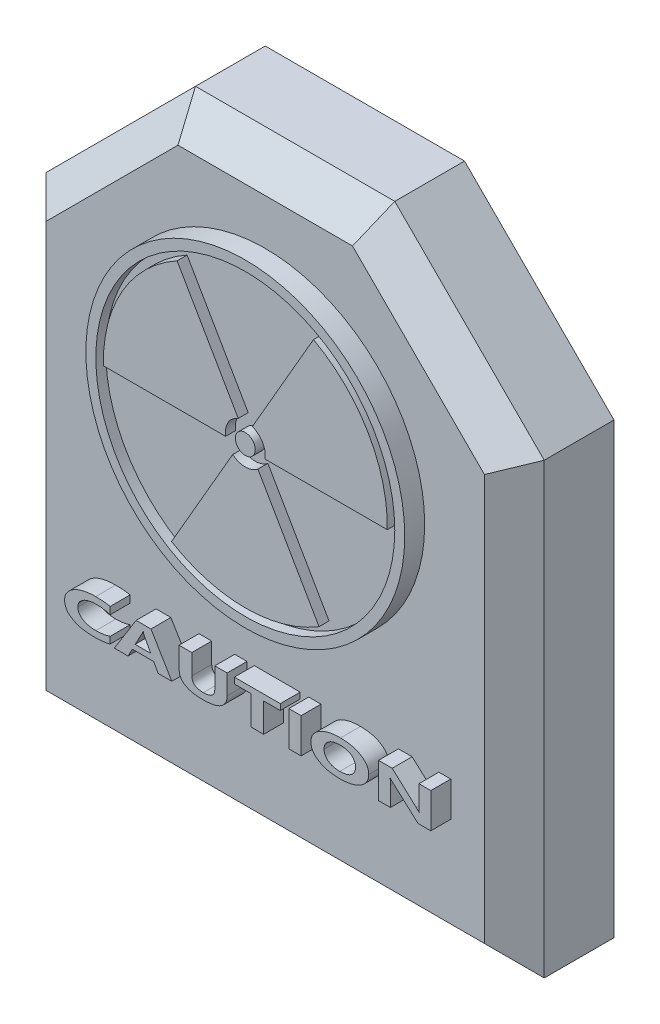
from build123d import *

# Parameters (mm, degrees)
EXTRUDE_1_DEPTH     = 10
CHAMFER_2_SIZE      = 3
SKETCH_2_R          = 16
EXTRUDE_2_DEPTH     = 2
SKETCH_5_R          = 15
CUT_EXTRUDE_4_DEPTH = 1
SKETCH_6_R          = 1
EXTRUDE_3_DEPTH     = 1
EXTRUDE_4_DEPTH     = 1
SKETCH_8_W          = 1.237804878
SKETCH_8_H          = 3.5
EXTRUDE_5_DEPTH     = 2


with BuildPart() as part:
    # 草图1 → 凸台-拉伸1 (new body)
    with BuildSketch(Plane.XY):
        Polygon((25, -30), (25, 15), (10, 30), (-10, 30), (-25, 15), (-25, -30), align=None)
    extrude(amount=EXTRUDE_1_DEPTH)

    # 倒角2
    chamfer_2_edges = [part.edges().sort_by_distance(p)[0] for p in [
        (17.5, 22.5, 10),
        (0, 30, 10),
        (-17.5, 22.5, 10),
        (-25, -7.5, 10),
        (0, -30, 10),
        (25, -7.5, 10),
    ]]
    chamfer(chamfer_2_edges, length=CHAMFER_2_SIZE)

    # 草图2 → 凸台-拉伸2 (add)
    with BuildSketch(Plane.XY.offset(10)):
        with Locations((0, 6.409945755)):
            Circle(SKETCH_2_R)
    extrude(amount=EXTRUDE_2_DEPTH)

    # 草图5 → 切除-拉伸4 (cut)
    with BuildSketch(Plane.XY.offset(12)):
        with Locations((0, 6.409945755)):
            Circle(SKETCH_5_R)
    extrude(amount=-CUT_EXTRUDE_4_DEPTH, mode=Mode.SUBTRACT)

    # 草图6 → 凸台-拉伸3 (add)
    with BuildSketch(Plane.XY.offset(11)):
        with Locations((0, 6.409945755)):
            Circle(SKETCH_6_R)
    extrude(amount=EXTRUDE_3_DEPTH)

    # 草图7 → 凸台-拉伸4 (add)
    with BuildSketch(Plane.XY.offset(11)):
        with BuildLine():
            Line((-1.265686668, 4.861386018), (-7.401451901, -5.766071109))
            ThreePointArc((-7.401451901, -5.766071109), (0, -7.839155161), (7.401451901, -5.766071109))
            Line((7.401451901, -5.766071109), (1.265686668, 4.861386018))
            ThreePointArc((1.265686668, 4.861386018), (0, 4.409945755), (-1.265686668, 4.861386018))
        make_face()
        with BuildLine():
            Line((-1.973935405, 6.088108815), (-14.245465871, 6.088108815))
            ThreePointArc((-14.245465871, 6.088108815), (-12.340083374, 13.534496212), (-6.84401397, 18.907799557))
            Line((-6.84401397, 18.907799557), (-0.708248737, 8.280342431))
            ThreePointArc((-0.708248737, 8.280342431), (-1.732050808, 7.409945755), (-1.973935405, 6.088108815))
        make_face()
        with BuildLine():
            Line((0.708248737, 8.280342431), (6.84401397, 18.907799557))
            ThreePointArc((6.84401397, 18.907799557), (12.340083374, 13.534496212), (14.245465871, 6.088108815))
            Line((14.245465871, 6.088108815), (1.973935405, 6.088108815))
            ThreePointArc((1.973935405, 6.088108815), (1.732050808, 7.409945755), (0.708248737, 8.280342431))
        make_face()
    extrude(amount=EXTRUDE_4_DEPTH)

    # 草图8 → 凸台-拉伸5 (add)
    # profile 1 of 7: a face of its own
    with BuildSketch(Plane.XY.offset(10)):
        with BuildLine():
            add(Edge.make_bspline(
                [(-13.564463489, -17.758880935), (-13.619913162, -17.77363801), (-13.734191594, -17.804051452), (-13.913498898, -17.840667452), (-14.104495385, -17.872930381), (-14.30817972, -17.89774859), (-14.523698367, -17.917572744), (-14.751637502, -17.932240405), (-14.99160415, -17.940976245), (-15.155728896, -17.941841226), (-15.239768368, -17.942284136)],
                knots=[0, 0, 0, 0, 0.814540508, 1.678718902, 2.597180682, 3.564186061, 4.591226106, 5.669787713, 6.806823395, 8, 8, 8, 8], degree=3))
            add(Edge.make_bspline(
                [(-15.239768368, -17.942284136), (-15.294459136, -17.941841418), (-15.402532416, -17.940966573), (-15.562439198, -17.93578415), (-15.718070445, -17.926195549), (-15.869348306, -17.913930238), (-16.016288974, -17.896930844), (-16.158937483, -17.877330551), (-16.297211827, -17.853092042), (-16.431295423, -17.825685477), (-16.56149188, -17.795658495), (-16.686780208, -17.759533493), (-16.808352208, -17.722160044), (-16.92533633, -17.679916279), (-17.037850982, -17.63393687), (-17.1463597, -17.584619228), (-17.250305475, -17.531065271), (-17.350259636, -17.474781115), (-17.444549196, -17.414980644), (-17.533057812, -17.35257565), (-17.615908607, -17.288359819), (-17.691879436, -17.220413876), (-17.762965456, -17.151455682), (-17.827234909, -17.079289291), (-17.88446703, -17.004132215), (-17.936881147, -16.927422478), (-17.983207286, -16.848034961), (-18.022139221, -16.7655749), (-18.056821151, -16.681525601), (-18.08381453, -16.594583417), (-18.105417324, -16.505286253), (-18.120692501, -16.413695581), (-18.129349477, -16.319387889), (-18.13080001, -16.255881151), (-18.13153666, -16.22362941)],
                knots=[0, 0, 0, 0, 1.405321778, 2.7770269, 4.110385158, 5.411603609, 6.676389985, 7.910768113, 9.11095572, 10.282764004, 11.427228887, 12.542993861, 13.63242037, 14.694871024, 15.737605919, 16.754966642, 17.756423054, 18.741271285, 19.701611664, 20.623978926, 21.523275293, 22.393285382, 23.241551987, 24.066969396, 24.873593052, 25.667351333, 26.453114915, 27.232373444, 28.008842418, 28.78749355, 29.568905568, 30.368071709, 31.171229226, 32, 32, 32, 32], degree=3))
            add(Edge.make_bspline(
                [(-18.13153666, -16.22362941), (-18.130887062, -16.189816954), (-18.129597815, -16.122709866), (-18.119556531, -16.023234199), (-18.101980073, -15.926128154), (-18.078095515, -15.831353696), (-18.047178222, -15.738903546), (-18.009868045, -15.648804226), (-17.965616084, -15.560913613), (-17.914189333, -15.475635746), (-17.855791102, -15.392706061), (-17.79111408, -15.311949964), (-17.71956323, -15.233788292), (-17.640836192, -15.158226541), (-17.555994719, -15.084236072), (-17.463309418, -15.01365583), (-17.364503465, -14.944914641), (-17.259540473, -14.878489283), (-17.148973871, -14.81524427), (-17.033932539, -14.756033117), (-16.914465959, -14.701333117), (-16.791644647, -14.649868355), (-16.664328182, -14.603500477), (-16.533804547, -14.559724227), (-16.398822325, -14.521349855), (-16.260041362, -14.486594635), (-16.117214855, -14.456052879), (-15.970491302, -14.429099301), (-15.819550032, -14.407674513), (-15.665099342, -14.388477657), (-15.506439319, -14.375043882), (-15.344162588, -14.363966287), (-15.177566523, -14.358091872), (-15.065261394, -14.357313002), (-15.008346874, -14.356918282)],
                knots=[0, 0, 0, 0, 0.807102831, 1.601845173, 2.383635543, 3.161072714, 3.93305667, 4.708698518, 5.487167482, 6.279905024, 7.083791039, 7.90680648, 8.74823224, 9.611467058, 10.510610991, 11.434092871, 12.391020215, 13.38336136, 14.398389843, 15.430873973, 16.470940906, 17.534385457, 18.608974408, 19.704857265, 20.820189643, 21.958021915, 23.119664682, 24.306349661, 25.518454119, 26.758616571, 28.021307383, 29.319000445, 30.641310477, 32, 32, 32, 32], degree=3))
            add(Edge.make_bspline(
                [(-15.008346874, -14.356918282), (-14.937871914, -14.357300767), (-14.800007763, -14.358048989), (-14.597416029, -14.363948848), (-14.40374279, -14.374657936), (-14.218713889, -14.389199831), (-14.042575811, -14.407834664), (-13.875238409, -14.430169277), (-13.71662789, -14.457407239), (-13.614412523, -14.479504352), (-13.564463489, -14.490302429)],
                knots=[0, 0, 0, 0, 1.164097413, 2.277224473, 3.347409999, 4.367775645, 5.342638588, 6.272745001, 7.155951581, 8, 8, 8, 8], degree=3))
            Line((-13.564463489, -14.490302429), (-13.564463489, -15.210576819))
            add(Edge.make_bspline(
                [(-13.564463489, -15.210576819), (-13.614765367, -15.193390019), (-13.716166778, -15.158743882), (-13.872773361, -15.11574554), (-14.034322291, -15.07899731), (-14.201029754, -15.049144593), (-14.372583951, -15.025819297), (-14.549021436, -15.009277437), (-14.730340592, -14.99902641), (-14.852940739, -14.997788555), (-14.914977971, -14.997162185)],
                knots=[0, 0, 0, 0, 0.928365014, 1.871451487, 2.835162954, 3.821577475, 4.828785264, 5.85854989, 6.916399036, 8, 8, 8, 8], degree=3))
            add(Edge.make_bspline(
                [(-14.914977971, -14.997162185), (-14.985029233, -14.998259063), (-15.121731855, -15.000399582), (-15.321282587, -15.014920735), (-15.510026929, -15.039879059), (-15.687860175, -15.076290915), (-15.855613463, -15.120823653), (-16.012164661, -15.176972442), (-16.157811649, -15.243288663), (-16.291920641, -15.318610918), (-16.412839014, -15.402224383), (-16.518292605, -15.4931363), (-16.607884867, -15.590289701), (-16.681622099, -15.693507622), (-16.738195456, -15.803746397), (-16.779282942, -15.919810019), (-16.803966456, -16.042744847), (-16.806881827, -16.126813006), (-16.808365928, -16.169608831)],
                knots=[0, 0, 0, 0, 1.359510936, 2.653038681, 3.880729034, 5.051800413, 6.17378212, 7.246458049, 8.275540338, 9.276284984, 10.227799738, 11.123984125, 11.972902942, 12.786929991, 13.5780881, 14.369540265, 15.16999646, 16, 16, 16, 16], degree=3))
            add(Edge.make_bspline(
                [(-16.808365928, -16.169608831), (-16.807158184, -16.211308319), (-16.804787157, -16.293172202), (-16.780059225, -16.412332416), (-16.742623797, -16.525680325), (-16.687151345, -16.631851865), (-16.618339636, -16.732712182), (-16.533025519, -16.826512981), (-16.43301243, -16.914153418), (-16.318095027, -16.994469513), (-16.190348212, -17.066480801), (-16.051551094, -17.130332491), (-15.901680624, -17.183401964), (-15.741036327, -17.226475111), (-15.569687265, -17.260382945), (-15.387732712, -17.284751872), (-15.194892035, -17.299700773), (-15.062840012, -17.301246325), (-14.995008459, -17.302040234)],
                knots=[0, 0, 0, 0, 0.840201575, 1.649472592, 2.4451937, 3.241571885, 4.057712215, 4.90252238, 5.792400207, 6.735647849, 7.725925197, 8.747491776, 9.814352991, 10.929607197, 12.100408808, 13.336091528, 14.631622272, 16, 16, 16, 16], degree=3))
            add(Edge.make_bspline(
                [(-14.995008459, -17.302040234), (-14.930304093, -17.301411493), (-14.802151127, -17.300166213), (-14.612172112, -17.289885164), (-14.426624992, -17.273384587), (-14.24553166, -17.249990765), (-14.068835388, -17.220146741), (-13.896444301, -17.183265076), (-13.728258726, -17.140472629), (-13.618777467, -17.105817909), (-13.564463489, -17.088625599)],
                knots=[0, 0, 0, 0, 1.069091394, 2.117434131, 3.142735557, 4.146470838, 5.133833437, 6.102842958, 7.058814751, 8, 8, 8, 8], degree=3))
            Line((-13.564463489, -17.088625599), (-13.564463489, -17.758880935))
        make_face()
    # profile 2 of 7: a face of its own
    with BuildSketch(Plane.XY.offset(10)):
        Polygon((-7.375439099, -17.899601209), (-8.747961965, -17.899601209), (-9.19013041, -17.088625599), (-11.337615166, -17.088625599), (-11.772447483, -17.899601209), (-13.137634221, -17.899601209), (-10.960804953, -14.399601209), (-9.466902514, -14.399601209), align=None)
        with BuildLine():
            Line((-9.488243977, -16.533747551), (-10.143827057, -15.305946484))
            add(Edge.make_bspline(
                [(-10.143827057, -15.305946484), (-10.154286077, -15.285026396), (-10.176136524, -15.241321229), (-10.201187345, -15.168310611), (-10.220799516, -15.08601121), (-10.230248681, -15.027691694), (-10.235195197, -14.997162185)],
                knots=[0, 0, 0, 0, 0.866422683, 1.810085605, 2.853608277, 4, 4, 4, 4], degree=3))
            Line((-10.235195197, -14.997162185), (-10.277878124, -14.997162185))
            add(Edge.make_bspline(
                [(-10.277878124, -14.997162185), (-10.28256808, -15.022819619), (-10.292004092, -15.074441383), (-10.313976246, -15.150580022), (-10.344284804, -15.224948743), (-10.369293638, -15.272570684), (-10.381917758, -15.296609593)],
                knots=[0, 0, 0, 0, 0.981765586, 1.97527439, 2.977945975, 4, 4, 4, 4], degree=3))
            Line((-10.381917758, -15.296609593), (-11.062843825, -16.533747551))
            Line((-11.062843825, -16.533747551), (-9.488243977, -16.533747551))
        make_face(mode=Mode.SUBTRACT)
    # profile 3 of 7: a face of its own
    with BuildSketch(Plane.XY.offset(10)):
        with BuildLine():
            add(Edge.make_bspline(
                [(-1.826658611, -16.384357307), (-1.827283346, -16.416377405), (-1.828512448, -16.479373729), (-1.83486435, -16.572287005), (-1.847184034, -16.661956349), (-1.863482782, -16.748949811), (-1.885893143, -16.832699346), (-1.911422327, -16.913882727), (-1.943245111, -16.991410329), (-1.97901917, -17.066197282), (-2.020082117, -17.137772473), (-2.065198083, -17.206801369), (-2.116190261, -17.271837986), (-2.171088202, -17.334520943), (-2.231336353, -17.393686767), (-2.295963068, -17.450453608), (-2.365555726, -17.504129448), (-2.44046906, -17.553633628), (-2.519286786, -17.601547845), (-2.603414145, -17.645312008), (-2.692364131, -17.685926503), (-2.785848022, -17.723883483), (-2.884051854, -17.759449794), (-2.987366976, -17.791306155), (-3.095405299, -17.819633001), (-3.207817123, -17.84605584), (-3.325381094, -17.868365621), (-3.447653949, -17.888431145), (-3.574874134, -17.905146466), (-3.706798955, -17.918210497), (-3.843329403, -17.928827169), (-3.98473196, -17.936981482), (-4.130837077, -17.941666357), (-4.230015317, -17.942076403), (-4.280259983, -17.942284136)],
                knots=[0, 0, 0, 0, 0.935147002, 1.839807652, 2.71749129, 3.576858779, 4.422384529, 5.247657189, 6.060141729, 6.867292472, 7.666837077, 8.468040189, 9.273099865, 10.077976314, 10.899641179, 11.736877874, 12.588635506, 13.463650346, 14.357627314, 15.28098361, 16.230840637, 17.212099303, 18.226489284, 19.279825675, 20.367875957, 21.487460498, 22.651100883, 23.861322207, 25.105352078, 26.39722392, 27.732043386, 29.103978512, 30.532847187, 32, 32, 32, 32], degree=3))
            add(Edge.make_bspline(
                [(-4.280259983, -17.942284136), (-4.328950091, -17.942106449), (-4.424575523, -17.941757478), (-4.565758456, -17.936679011), (-4.702325129, -17.929748404), (-4.834389038, -17.918875697), (-4.961593152, -17.905645664), (-5.084193582, -17.88980974), (-5.202009983, -17.87031714), (-5.315761142, -17.848543082), (-5.424702786, -17.823160106), (-5.529165539, -17.795354477), (-5.628512575, -17.763853713), (-5.723332923, -17.729930694), (-5.813749084, -17.693172012), (-5.89968919, -17.653568656), (-5.980574633, -17.609693976), (-6.057235176, -17.564132842), (-6.129123501, -17.515056006), (-6.196296002, -17.463090034), (-6.259426378, -17.408632281), (-6.316685494, -17.350033118), (-6.370234642, -17.289523702), (-6.419196516, -17.22590442), (-6.463326296, -17.159037481), (-6.502588131, -17.088964287), (-6.537343782, -17.016112023), (-6.567515144, -16.94039674), (-6.592813379, -16.86171055), (-6.613188132, -16.780087707), (-6.630525541, -16.695650857), (-6.640970759, -16.60796659), (-6.649142024, -16.517449557), (-6.649597709, -16.456182716), (-6.649829343, -16.425039471)],
                knots=[0, 0, 0, 0, 1.467873628, 2.88284535, 4.258801599, 5.590190659, 6.877336588, 8.11436775, 9.316499241, 10.477165703, 11.605470324, 12.688266459, 13.735419922, 14.746673965, 15.723699492, 16.677247198, 17.597837422, 18.496700907, 19.364854443, 20.220158092, 21.056206145, 21.876113542, 22.688203729, 23.491198865, 24.294249941, 25.101485492, 25.910916169, 26.726125704, 27.556999609, 28.40066953, 29.261626756, 30.15364247, 31.061457018, 32, 32, 32, 32], degree=3))
            Line((-6.649829343, -16.425039471), (-6.649829343, -14.399601209))
            Line((-6.649829343, -14.399601209), (-5.369341538, -14.399601209))
            Line((-5.369341538, -14.399601209), (-5.369341538, -16.431041758))
            add(Edge.make_bspline(
                [(-5.369341538, -16.431041758), (-5.368441326, -16.46621025), (-5.366691046, -16.534588233), (-5.353254645, -16.633840909), (-5.330971997, -16.72639389), (-5.2983569, -16.811885092), (-5.258059799, -16.891254561), (-5.207195317, -16.962982923), (-5.148342954, -17.028785725), (-5.078586165, -17.085583491), (-5.001676043, -17.137813095), (-4.914691315, -17.181553707), (-4.818864071, -17.218892465), (-4.713897604, -17.249268342), (-4.599972573, -17.273156368), (-4.477221037, -17.290341527), (-4.345338395, -17.300245034), (-4.254489531, -17.301428808), (-4.207565624, -17.302040234)],
                knots=[0, 0, 0, 0, 1.019223664, 1.981673238, 2.897603254, 3.772556039, 4.628602701, 5.470684432, 6.314712036, 7.179447299, 8.071347677, 9.005172106, 9.994874332, 11.049188956, 12.169042722, 13.366603249, 14.63983698, 16, 16, 16, 16], degree=3))
            add(Edge.make_bspline(
                [(-4.207565624, -17.302040234), (-4.161303113, -17.30146888), (-4.071775628, -17.300363194), (-3.942240261, -17.289952716), (-3.821345014, -17.274643165), (-3.709566578, -17.251121995), (-3.606286346, -17.222292566), (-3.512129285, -17.185965362), (-3.426437064, -17.14368449), (-3.349966485, -17.094117739), (-3.282398429, -17.038334032), (-3.223659856, -16.975757664), (-3.174183216, -16.906147642), (-3.134068931, -16.829982034), (-3.102137376, -16.747752966), (-3.080717514, -16.658460341), (-3.067089417, -16.562843723), (-3.065353954, -16.496893147), (-3.064463489, -16.463053953)],
                knots=[0, 0, 0, 0, 1.374303357, 2.65956004, 3.859039507, 4.992559296, 6.050483239, 7.041633388, 7.986909769, 8.884650212, 9.743062248, 10.584249106, 11.427352876, 12.272446655, 13.136027453, 14.041173164, 14.994927324, 16, 16, 16, 16], degree=3))
            Line((-3.064463489, -16.463053953), (-3.064463489, -14.399601209))
            Line((-3.064463489, -14.399601209), (-1.826658611, -14.399601209))
            Line((-1.826658611, -14.399601209), (-1.826658611, -16.384357307))
        make_face()
    # profile 4 of 7: a face of its own
    with BuildSketch(Plane.XY.offset(10)):
        Polygon((3.508707242, -14.997162185), (1.844073096, -14.997162185), (1.844073096, -17.899601209), (0.563585291, -17.899601209), (0.563585291, -14.997162185), (-1.101048855, -14.997162185), (-1.101048855, -14.399601209), (3.508707242, -14.399601209), align=None)
    # profile 5 of 7: a face of its own
    with BuildSketch(Plane.XY.offset(10)):
        with Locations((4.981268218, -16.149601209)):
            Rectangle(SKETCH_8_W, SKETCH_8_H)
    # profile 6 of 7: a face of its own
    with BuildSketch(Plane.XY.offset(10)):
        with BuildLine():
            add(Edge.make_bspline(
                [(6.581877974, -16.194284898), (6.582560185, -16.160695541), (6.583909175, -16.094276641), (6.593414259, -15.995768394), (6.60924983, -15.899674197), (6.632235001, -15.805965252), (6.660840979, -15.714587254), (6.695441611, -15.625488261), (6.737337066, -15.539000701), (6.784983528, -15.454621752), (6.83955952, -15.372756314), (6.900172185, -15.293264059), (6.967992164, -15.216684626), (7.041233789, -15.141867514), (7.12110176, -15.069679147), (7.207063267, -14.999521025), (7.300113042, -14.932487807), (7.398418842, -14.867097684), (7.502248392, -14.805434743), (7.610504199, -14.747124896), (7.723105279, -14.693553196), (7.839376751, -14.642928936), (7.960375355, -14.598155239), (8.085002559, -14.555866282), (8.213854089, -14.517960759), (8.346658337, -14.483949874), (8.48347143, -14.453987281), (8.624485971, -14.427939123), (8.769744194, -14.406049239), (8.919203721, -14.388076802), (9.072661898, -14.374106058), (9.230115245, -14.364203222), (9.391565261, -14.358034729), (9.500539858, -14.357293381), (9.555677517, -14.356918282)],
                knots=[0, 0, 0, 0, 0.831428117, 1.644048752, 2.447430395, 3.240263237, 4.030456037, 4.816325404, 5.603965443, 6.407365934, 7.213250477, 8.037655406, 8.879940025, 9.743843858, 10.628205639, 11.54354679, 12.489092848, 13.465925615, 14.465391661, 15.477324414, 16.508658615, 17.551367499, 18.615408818, 19.701325791, 20.808782067, 21.939297036, 23.094299092, 24.275127767, 25.488477537, 26.730101316, 28.001086176, 29.302445612, 30.635123819, 32, 32, 32, 32], degree=3))
            add(Edge.make_bspline(
                [(9.555677517, -14.356918282), (9.608148883, -14.357274208), (9.7117926, -14.357977246), (9.865434244, -14.364420612), (10.015132424, -14.373352917), (10.161026286, -14.386797062), (10.302931937, -14.40405111), (10.441091216, -14.42525011), (10.575305708, -14.450984073), (10.705944326, -14.478889481), (10.832219462, -14.512981524), (10.954844663, -14.548991026), (11.073149266, -14.590273046), (11.18829864, -14.633862918), (11.299127426, -14.682643183), (11.406310493, -14.734612565), (11.50924151, -14.79088523), (11.608053517, -14.850500036), (11.702198778, -14.91323131), (11.790758658, -14.97819782), (11.872914398, -15.0458829), (11.949475451, -15.114927092), (12.018439809, -15.187543213), (12.083384423, -15.260793368), (12.140958406, -15.337303903), (12.192714665, -15.416014835), (12.238919214, -15.496394856), (12.278219326, -15.579487952), (12.311850184, -15.664534214), (12.339110647, -15.751950386), (12.360449752, -15.841530025), (12.37604728, -15.933281978), (12.384499546, -16.027395375), (12.385999508, -16.090896979), (12.386756023, -16.12292438)],
                knots=[0, 0, 0, 0, 1.360925128, 2.688158275, 3.988054692, 5.250357864, 6.487667463, 7.695441834, 8.874971668, 10.032018654, 11.159315174, 12.266674296, 13.346195445, 14.40848537, 15.459415599, 16.485793153, 17.4972911, 18.501018141, 19.478157884, 20.430762718, 21.348471185, 22.238256186, 23.102796595, 23.944656836, 24.776145176, 25.583779018, 26.38695441, 27.178768899, 27.965781915, 28.757281412, 29.551674118, 30.352693998, 31.169171706, 32, 32, 32, 32], degree=3))
            add(Edge.make_bspline(
                [(12.386756023, -16.12292438), (12.386061296, -16.156290073), (12.384683036, -16.22248387), (12.375315468, -16.320568146), (12.359234658, -16.416125087), (12.337004891, -16.509191835), (12.309496168, -16.600263653), (12.273488017, -16.688045816), (12.232931732, -16.774124208), (12.185304614, -16.85763114), (12.131272767, -16.938874673), (12.071101856, -17.017721921), (12.004660092, -17.094057571), (11.932009408, -17.168193732), (11.852250933, -17.239346318), (11.766957371, -17.308775843), (11.675347825, -17.375732579), (11.577370811, -17.439029542), (11.475197782, -17.500879425), (11.36750225, -17.556848865), (11.256803698, -17.610656283), (11.141913726, -17.659896932), (11.023109179, -17.705291361), (10.900460441, -17.746471561), (10.773939788, -17.784047865), (10.643516791, -17.817186534), (10.508885541, -17.846424669), (10.370664464, -17.872742564), (10.228167255, -17.893533056), (10.082166388, -17.912093937), (9.931944146, -17.924835248), (9.778097869, -17.935053448), (9.620196049, -17.941161795), (9.51366669, -17.941906475), (9.459640931, -17.942284136)],
                knots=[0, 0, 0, 0, 0.837525221, 1.661556201, 2.470714506, 3.267950681, 4.062251873, 4.856023616, 5.647280558, 6.449500967, 7.26670127, 8.094860018, 8.93742682, 9.805569529, 10.698608237, 11.61895173, 12.56546755, 13.545221531, 14.546277856, 15.562248261, 16.590557544, 17.635449654, 18.698776203, 19.7822943, 20.882313151, 22.011100359, 23.159321488, 24.34027223, 25.542236956, 26.773597919, 28.034138991, 29.325926748, 30.643858951, 32, 32, 32, 32], degree=3))
            add(Edge.make_bspline(
                [(9.459640931, -17.942284136), (9.406951641, -17.941827331), (9.302880296, -17.940925054), (9.148502964, -17.935937248), (8.997999873, -17.925509005), (8.850948709, -17.912531613), (8.707778373, -17.894960419), (8.568251241, -17.874592543), (8.432588675, -17.849784019), (8.300632524, -17.821304366), (8.172606658, -17.788442933), (8.048160784, -17.752537513), (7.927546978, -17.712586188), (7.810680873, -17.66866035), (7.697894576, -17.62029206), (7.588367366, -17.5692863), (7.482769772, -17.513670101), (7.381327077, -17.454675889), (7.284574916, -17.392845741), (7.193979334, -17.328294476), (7.109681068, -17.261425675), (7.031555727, -17.192645632), (6.959059697, -17.122145132), (6.893874407, -17.048397875), (6.833870767, -16.973205515), (6.781735182, -16.894708001), (6.733562163, -16.815427292), (6.693023448, -16.733217791), (6.658805462, -16.648693712), (6.630922501, -16.561944301), (6.608612997, -16.473115714), (6.593586143, -16.382091824), (6.58386008, -16.288975878), (6.582543926, -16.22609937), (6.581877974, -16.194284898)],
                knots=[0, 0, 0, 0, 1.357264453, 2.680854838, 3.977867612, 5.24286972, 6.4830145, 7.69292476, 8.874534241, 10.034790147, 11.169498205, 12.278587333, 13.37052852, 14.441548193, 15.493476288, 16.530965777, 17.552978986, 18.566567162, 19.553004232, 20.509586556, 21.430735607, 22.323355584, 23.189916464, 24.033544936, 24.857230744, 25.665646907, 26.459160865, 27.245368063, 28.02375774, 28.806076421, 29.590780672, 30.380628942, 31.18062504, 32, 32, 32, 32], degree=3))
        make_face()
        with BuildLine():
            add(Edge.make_bspline(
                [(7.905048706, -16.154269654), (7.906365241, -16.195466567), (7.908956314, -16.276546214), (7.928391017, -16.395395206), (7.962067867, -16.508135788), (8.008588006, -16.615051297), (8.067426455, -16.716754745), (8.140978667, -16.811567134), (8.227167954, -16.900870058), (8.325694171, -16.983774101), (8.435441088, -17.059330033), (8.556449708, -17.123688415), (8.686394455, -17.179384123), (8.826323377, -17.224811378), (8.976229164, -17.258781396), (9.135443974, -17.284437477), (9.304652008, -17.298784905), (9.420711364, -17.300935673), (9.480315474, -17.302040234)],
                knots=[0, 0, 0, 0, 0.905514958, 1.782144064, 2.638844986, 3.485984182, 4.34018586, 5.215110191, 6.117295066, 7.064129082, 8.041563836, 9.040931391, 10.072248731, 11.146451825, 12.270373584, 13.448341787, 14.689555729, 16, 16, 16, 16], degree=3))
            add(Edge.make_bspline(
                [(9.480315474, -17.302040234), (9.54103777, -17.301261227), (9.659113758, -17.29974643), (9.831052599, -17.284656579), (9.992803835, -17.260924797), (10.144418823, -17.228203623), (10.285288348, -17.184515275), (10.416128444, -17.132058286), (10.53659408, -17.069335337), (10.64613725, -16.997154405), (10.744602478, -16.917504705), (10.829728169, -16.829782791), (10.901738912, -16.735379319), (10.961978876, -16.635165305), (11.007280519, -16.527169714), (11.040090543, -16.41328835), (11.05983061, -16.292560642), (11.062313841, -16.209920839), (11.063585291, -16.167608069)],
                knots=[0, 0, 0, 0, 1.330927905, 2.588021802, 3.780409594, 4.913234084, 5.984593266, 7.009971996, 7.999635215, 8.956647863, 9.881462501, 10.770676031, 11.629438336, 12.479471574, 13.326748023, 14.188988231, 15.072735892, 16, 16, 16, 16], degree=3))
            add(Edge.make_bspline(
                [(11.063585291, -16.167608069), (11.062625313, -16.123507797), (11.060748797, -16.037302877), (11.040449766, -15.91197316), (11.009671032, -15.793295764), (10.964380606, -15.682283287), (10.907688654, -15.577626882), (10.836563311, -15.481401525), (10.754213059, -15.391059844), (10.658270359, -15.309471646), (10.551719588, -15.235345689), (10.43409377, -15.171062854), (10.306187999, -15.117171031), (10.167713682, -15.073204751), (10.01917336, -15.038798084), (9.860238616, -15.014355628), (9.691126019, -14.999498224), (9.574827423, -14.997955744), (9.514995352, -14.997162185)],
                knots=[0, 0, 0, 0, 0.965632101, 1.88756747, 2.775069239, 3.647193673, 4.508431957, 5.376683172, 6.262846729, 7.181790803, 8.130511132, 9.102952513, 10.113704346, 11.167567257, 12.283147128, 13.451773539, 14.689015401, 16, 16, 16, 16], degree=3))
            add(Edge.make_bspline(
                [(9.514995352, -14.997162185), (9.454279675, -14.998270444), (9.335779321, -15.000433461), (9.163034385, -15.014787145), (9.000167575, -15.040228793), (8.847306904, -15.075121944), (8.704311798, -15.12065877), (8.571122214, -15.175853207), (8.447729533, -15.241351243), (8.335157861, -15.316503239), (8.234435237, -15.399720569), (8.146287814, -15.489383588), (8.071664197, -15.585332471), (8.010195627, -15.687218666), (7.96350374, -15.795788565), (7.929074568, -15.909772138), (7.908748117, -16.030163229), (7.906296802, -16.112399018), (7.905048706, -16.154269654)],
                knots=[0, 0, 0, 0, 1.312494833, 2.561630059, 3.743585561, 4.873159611, 5.947651557, 6.983815174, 7.985643775, 8.962613865, 9.904636102, 10.805184937, 11.675119901, 12.526472825, 13.370141507, 14.223066294, 15.095268046, 16, 16, 16, 16], degree=3))
        make_face(mode=Mode.SUBTRACT)
    # profile 7 of 7: a face of its own
    with BuildSketch(Plane.XY.offset(10)):
        with BuildLine():
            Line((18.61846334, -17.899601209), (17.329972486, -17.899601209))
            Line((17.329972486, -17.899601209), (14.829019742, -15.635405325))
            add(Edge.make_bspline(
                [(14.829019742, -15.635405325), (14.798643793, -15.607545687), (14.741734913, -15.555351078), (14.6643191, -15.480207633), (14.600152566, -15.413491055), (14.563621695, -15.370359008), (14.546912273, -15.350630173)],
                knots=[0, 0, 0, 0, 1.232804885, 2.309641201, 3.226820571, 4, 4, 4, 4], degree=3))
            Line((14.546912273, -15.350630173), (14.527571572, -15.350630173))
            add(Edge.make_bspline(
                [(14.527571572, -15.350630173), (14.530611254, -15.366611372), (14.537088226, -15.400664208), (14.544129404, -15.455229139), (14.549821604, -15.515981433), (14.555663414, -15.582631973), (14.558087719, -15.655421432), (14.562267871, -15.734290493), (14.562945089, -15.819476404), (14.563367119, -15.87838803), (14.563585291, -15.908842825)],
                knots=[0, 0, 0, 0, 0.696883237, 1.484922983, 2.355919619, 3.311454863, 4.350763018, 5.475712275, 6.69505102, 8, 8, 8, 8], degree=3))
            Line((14.563585291, -15.908842825), (14.563585291, -17.899601209))
            Line((14.563585291, -17.899601209), (13.36846334, -17.899601209))
            Line((13.36846334, -17.899601209), (13.36846334, -14.399601209))
            Line((13.36846334, -14.399601209), (14.740986206, -14.399601209))
            Line((14.740986206, -14.399601209), (17.150570809, -16.600439624))
            add(Edge.make_bspline(
                [(17.150570809, -16.600439624), (17.169718024, -16.617747875), (17.206138089, -16.650670031), (17.257512992, -16.698002439), (17.302745998, -16.740591926), (17.342045409, -16.77822426), (17.37633571, -16.809938254), (17.404062703, -16.837352117), (17.426474736, -16.859202302), (17.43873076, -16.872717432), (17.444015931, -16.878545569)],
                knots=[0, 0, 0, 0, 1.531834616, 2.913714348, 4.14575539, 5.218996997, 6.143027779, 6.917421007, 7.533158885, 8, 8, 8, 8], degree=3))
            Line((17.444015931, -16.878545569), (17.463356632, -16.878545569))
            add(Edge.make_bspline(
                [(17.463356632, -16.878545569), (17.460050331, -16.866807685), (17.452816647, -16.841126984), (17.445594408, -16.798392036), (17.437704668, -16.748919745), (17.433172356, -16.692056713), (17.42793006, -16.628086173), (17.425975292, -16.556648768), (17.42359925, -16.478186395), (17.423429633, -16.423486025), (17.423341389, -16.395028038)],
                knots=[0, 0, 0, 0, 0.60116096, 1.315248506, 2.135687294, 3.071960308, 4.127540526, 5.301776985, 6.596243586, 8, 8, 8, 8], degree=3))
            Line((17.423341389, -16.395028038), (17.423341389, -14.399601209))
            Line((17.423341389, -14.399601209), (18.61846334, -14.399601209))
            Line((18.61846334, -14.399601209), (18.61846334, -17.899601209))
        make_face()
    extrude(amount=EXTRUDE_5_DEPTH)


solid = part.part
